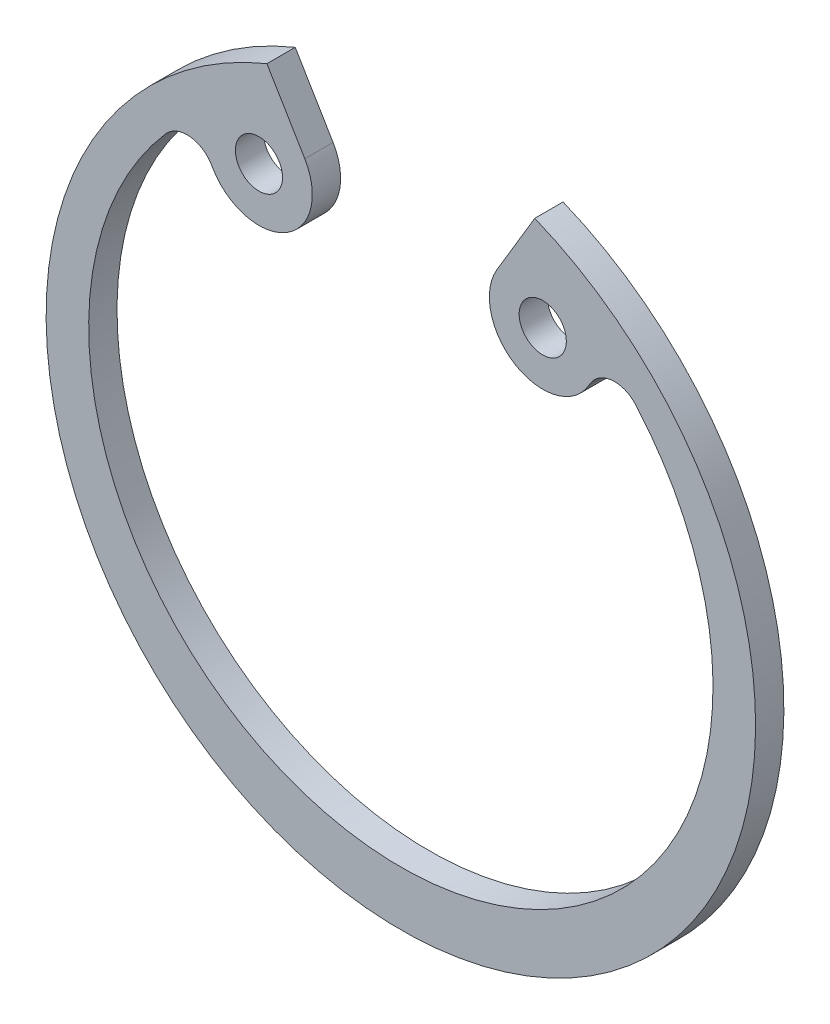
from build123d import *

# Parameters (mm, degrees)
SKETCH1_R           = 1.25
BOSS_EXTRUDE1_DEPTH = 0.75
FILLET1_R           = 1.5


with BuildPart() as part:
    # Sketch1 → Boss-Extrude1 (new, symmetric)
    with BuildSketch(Plane.XY):
        with BuildLine():
            Line((7.097768331, 17.408666943), (5.091491735, 14.047621322))
            ThreePointArc((5.091491735, 14.047621322), (6.070373947, 10.169487005), (9.948508265, 11.148369217))
            Line((9.948508265, 11.148369217), (11.028531075, 12.957693985))
            ThreePointArc((11.028531075, 12.957693985), (0, -15.918193069), (-11.028531075, 12.957693985))
            Line((-11.028531075, 12.957693985), (-9.948508265, 11.148369217))
            ThreePointArc((-9.948508265, 11.148369217), (-6.070373947, 10.169487005), (-5.091491735, 14.047621322))
            Line((-5.091491735, 14.047621322), (-7.097768331, 17.408666943))
            ThreePointArc((-7.097768331, 17.408666943), (0, -18.8), (7.097768331, 17.408666943))
        make_face()
        with Locations(Location((-7.52, 12.59799527, 0), (0, 0, 180))):
            Circle(SKETCH1_R, mode=Mode.SUBTRACT)
        with Locations((7.52, 12.59799527)):
            Circle(SKETCH1_R, mode=Mode.SUBTRACT)
    extrude(amount=BOSS_EXTRUDE1_DEPTH, both=True)

    # Fillet1
    fillet1_edges = [part.edges().sort_by_distance(p)[0] for p in [
        (-11.028531075, 12.957693985, 0),
        (11.028531075, 12.957693985, 0),
    ]]
    fillet(fillet1_edges, radius=FILLET1_R)


solid = part.part
